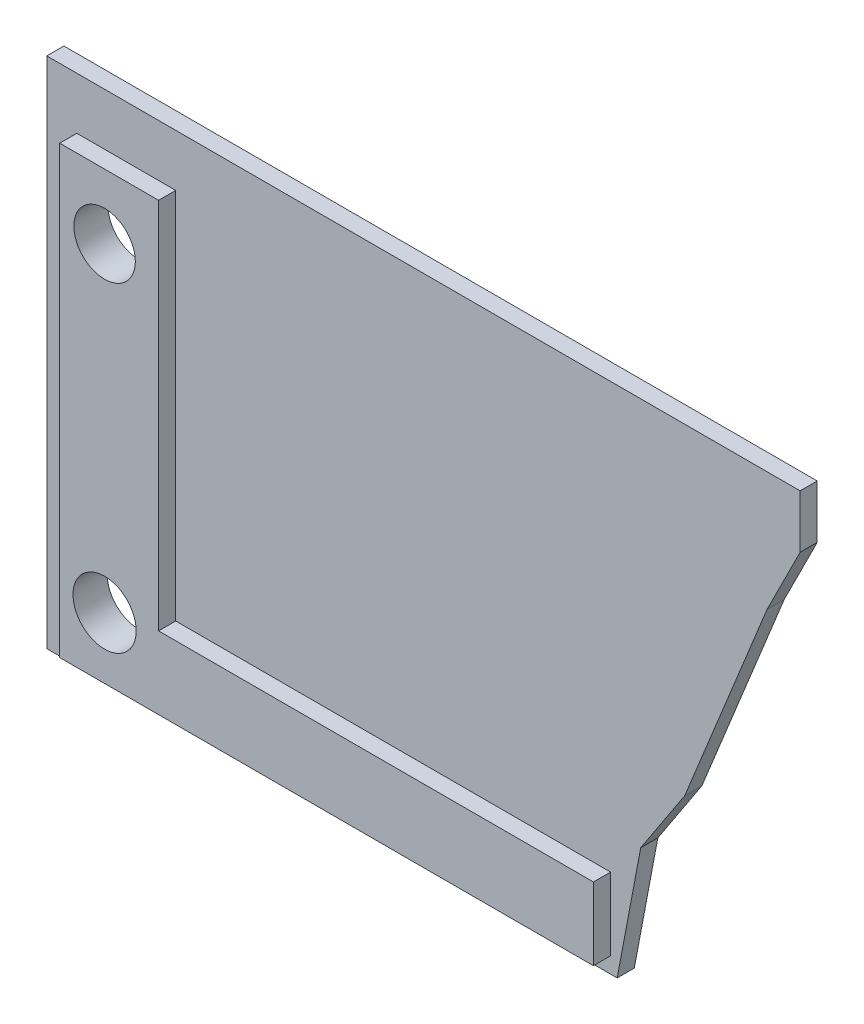
from build123d import *

# Parameters (mm, degrees)
SALIENTE_EXTRUIR1_DEPTH = 6
CROQUIS2_W              = 34.669355488
CROQUIS2_H              = 156.198494079
SALIENTE_EXTRUIR2_DEPTH = 6
CROQUIS4_W              = 152.460808534
CROQUIS4_H              = 25.435907393
SALIENTE_EXTRUIR3_DEPTH = 6
CROQUIS5_R              = 11.076486621
CROQUIS5_R_2            = 10.775241997
CORTAR_EXTRUIR1_DEPTH   = 12


with BuildPart() as part:
    # Croquis1 → Saliente-Extruir1 (new body)
    with BuildSketch(Plane.XY):
        Polygon((182.356839795, 53.079696336), (196.865539042, 88.764755078), (208.451032663, 111.909466833), (208.451032663, 130.571133231), (182.356839795, 130.571133231), (-55.686414529, 130.571133231), (-55.686414529, -49.428866769), (144.313585471, -49.428866769), (152.562750691, -5.750074162), (168.005565446, 17.781834037), align=None)
    extrude(amount=SALIENTE_EXTRUIR1_DEPTH)

    # Croquis2 → Saliente-Extruir2 (add)
    with BuildSketch(Plane.XY.offset(6)):
        with Locations((-27.81215178, 34.233724164)):
            Rectangle(CROQUIS2_W, CROQUIS2_H)
    extrude(amount=SALIENTE_EXTRUIR2_DEPTH)

    # Croquis4 → Saliente-Extruir3 (add)
    with BuildSketch(Plane.XY.offset(6)):
        with Locations((65.752930231, -31.14756918)):
            Rectangle(CROQUIS4_W, CROQUIS4_H)
    extrude(amount=SALIENTE_EXTRUIR3_DEPTH)

    # Croquis5 → Cortar-Extruir1 (cut)
    with BuildSketch(Plane.XY.offset(12)):
        with Locations((-29.411710595, -22.364568106)):
            Circle(CROQUIS5_R)
        with Locations((-29.411710595, 89.657796537)):
            Circle(CROQUIS5_R_2)
    extrude(amount=-CORTAR_EXTRUIR1_DEPTH, mode=Mode.SUBTRACT)


solid = part.part
